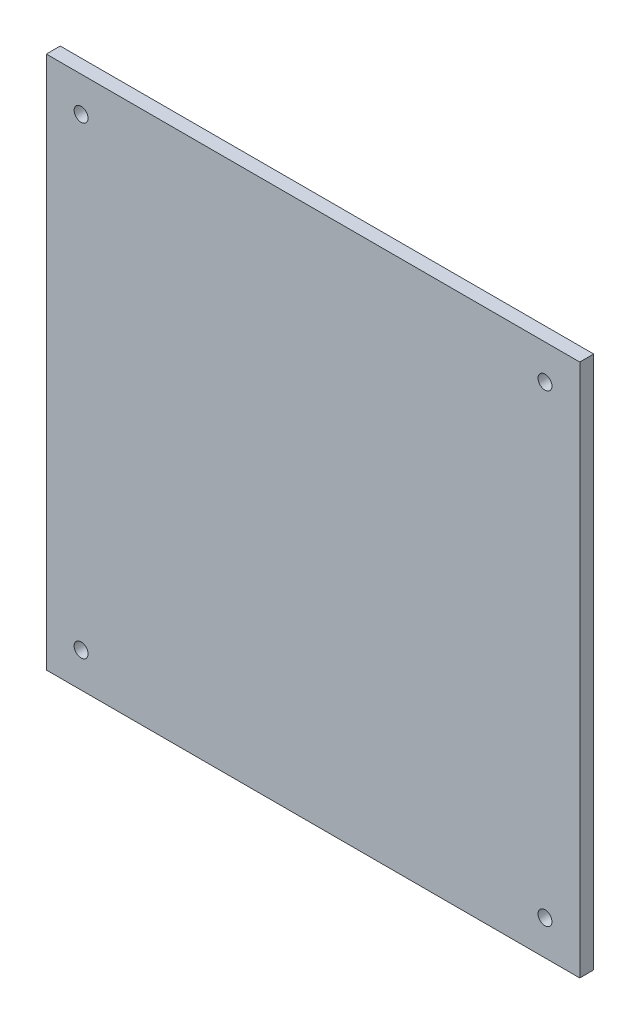
from build123d import *

# Parameters (mm, degrees)
SKETCH1_W           = 115
SKETCH1_H           = 115
SKETCH1_R           = 1.5
BOSS_EXTRUDE1_DEPTH = 3


with BuildPart() as part:
    # Sketch1 → Boss-Extrude1 (new body)
    with BuildSketch(Plane.XY):
        Rectangle(SKETCH1_W, SKETCH1_H)
        with Locations((-50, 50)):
            Circle(SKETCH1_R, mode=Mode.SUBTRACT)
        with Locations((50, 50)):
            Circle(SKETCH1_R, mode=Mode.SUBTRACT)
        with Locations((-50, -50)):
            Circle(SKETCH1_R, mode=Mode.SUBTRACT)
        with Locations((50, -50)):
            Circle(SKETCH1_R, mode=Mode.SUBTRACT)
    extrude(amount=BOSS_EXTRUDE1_DEPTH)


solid = part.part
